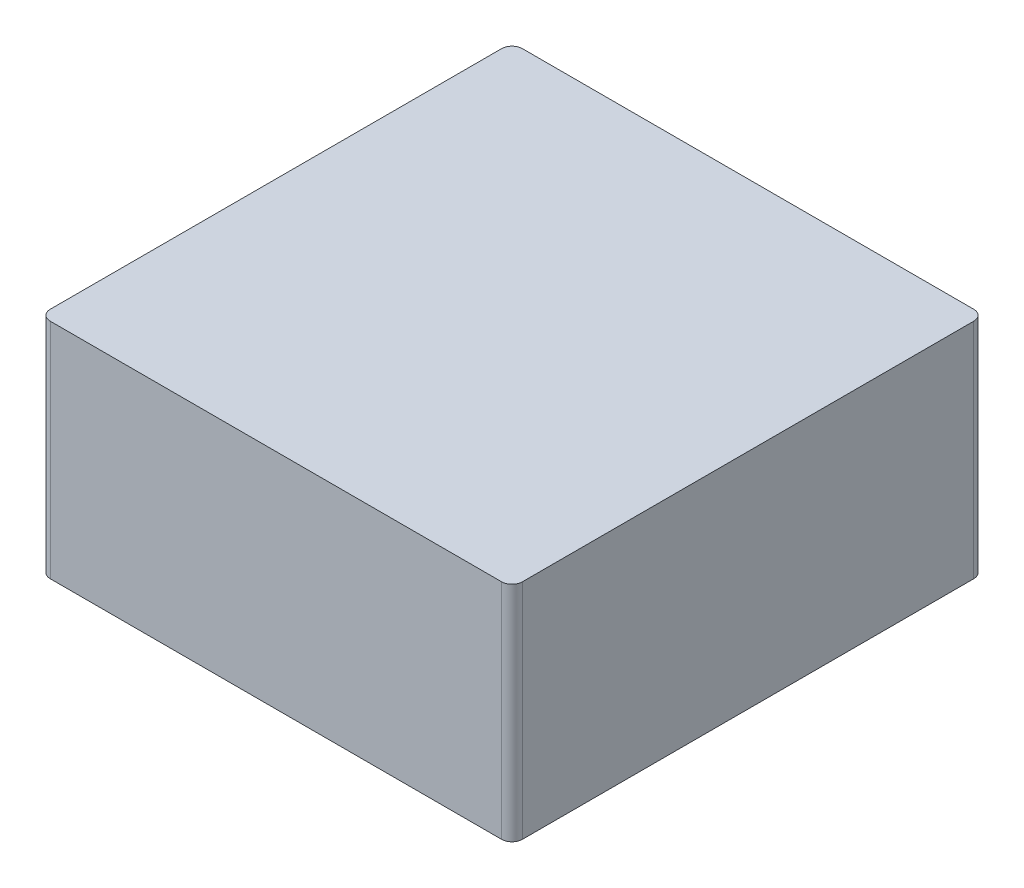
from build123d import *

# Parameters (mm, degrees)
SKETCH1_W           = 91
SKETCH1_H           = 91
SKETCH1_W_2         = 85
SKETCH1_H_2         = 85
BOSS_EXTRUDE1_DEPTH = 40
SKETCH2_W           = 91
SKETCH2_H           = 91
BOSS_EXTRUDE2_DEPTH = 3
FILLET1_R           = 2
SKETCH3_R           = 2.5
BOSS_EXTRUDE3_DEPTH = 3


with BuildPart() as part:
    # Sketch1 → Boss-Extrude1 (new body)
    with BuildSketch(Plane(origin=(0, 0, 0), x_dir=(1, 0, 0), z_dir=(0, 1, 0))):
        with Locations((-42.5, 42.5)):
            Rectangle(SKETCH1_W, SKETCH1_H)
        with Locations((-42.5, 42.5)):
            Rectangle(SKETCH1_W_2, SKETCH1_H_2, mode=Mode.SUBTRACT)
    extrude(amount=BOSS_EXTRUDE1_DEPTH)

    # Sketch2 → Boss-Extrude2 (add)
    with BuildSketch(Plane(origin=(0, 40, 0), x_dir=(1, 0, 0), z_dir=(0, 1, 0))):
        with Locations((-42.5, 42.5)):
            Rectangle(SKETCH2_W, SKETCH2_H)
    extrude(amount=BOSS_EXTRUDE2_DEPTH)

    # Fillet1
    fillet1_edges = [part.edges().sort_by_distance(p)[0] for p in [
        (3, 21.5, -88),
        (3, 21.5, 3),
        (-88, 21.5, 3),
        (-88, 21.5, -88),
    ]]
    fillet(fillet1_edges, radius=FILLET1_R)

    # Sketch3 → Boss-Extrude3 (add)
    with BuildSketch(Plane.XZ.offset(-40)):
        with Locations(Location((-66.5, -29.5, 0), (0, 0, 270))):
            Circle(SKETCH3_R)
        with Locations(Location((-66.5, -55.5, 0), (0, 0, 90))):
            Circle(SKETCH3_R)
        with Locations(Location((-18.5, -55.5, 0), (0, 0, 270))):
            Circle(SKETCH3_R)
        with Locations(Location((-18.5, -29.5, 0), (0, 0, 90))):
            Circle(SKETCH3_R)
    extrude(amount=BOSS_EXTRUDE3_DEPTH)


solid = part.part
